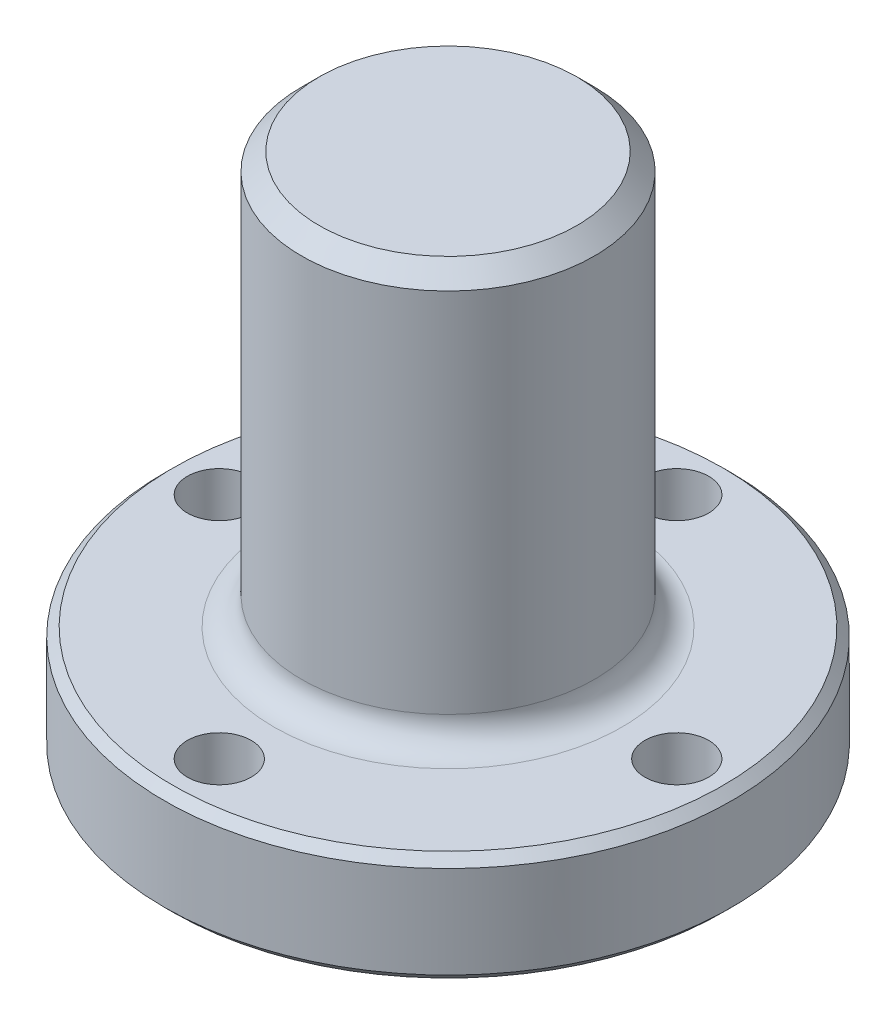
from build123d import *

# Parameters (mm, degrees)
CUT_EXTRUDE2_START = -20.2057
SKETCH2_R          = 2.7686
CUT_EXTRUDE2_DEPTH = 9.525
CUT_EXTRUDE4_START = -20.2057
SKETCH3_R          = 2.7686
CUT_EXTRUDE4_DEPTH = 9.525
FILLET1_R          = 2.3876
CHAMFER1_SIZE      = 0.762
CHAMFER2_SIZE      = 1.524


with BuildPart() as part:
    # Sketch1 → Revolve1 (revolve)
    with BuildSketch(Plane(origin=(0, 0, 0), x_dir=(0, 1, 0), z_dir=(0, 0, 1)), mode=Mode.PRIVATE) as revolve1_sk:
        Polygon((-25.0317, 0), (-25.0317, 8.7122), (-20.2057, 8.7122), (-20.2057, 24.6126), (-10.6807, 24.6126), (-10.6807, 12.7), (25.0317, 12.7), (25.0317, 0), align=None)
    revolve(revolve1_sk.sketch.rotate(Axis((0, -50.4317, 0), (0, 1, 0)), 270), axis=Axis((0, -50.4317, 0), (0, 1, 0)))

    # Sketch2 → Cut-Extrude2 (cut)
    with BuildSketch(Plane(origin=(0, 0, 0), x_dir=(-1, 0, 0), z_dir=(0, 1, 0)).offset(CUT_EXTRUDE2_START)):
        with Locations(Location((19.8374, 0, 0), (0, 0, 270))):
            Circle(SKETCH2_R)
    extrude(amount=CUT_EXTRUDE2_DEPTH, mode=Mode.SUBTRACT)

    # Sketch3 → Cut-Extrude4 (cut)
    with BuildSketch(Plane(origin=(0, 0, 0), x_dir=(-1, 0, 0), z_dir=(0, 1, 0)).offset(CUT_EXTRUDE4_START)):
        with Locations(Location((0, 19.8374, 0), (0, 0, 270))):
            Circle(SKETCH3_R)
        with Locations(Location((-19.8374, 0, 0), (0, 0, 270))):
            Circle(SKETCH3_R)
        with Locations(Location((0, -19.8374, 0), (0, 0, 270))):
            Circle(SKETCH3_R)
    extrude(amount=CUT_EXTRUDE4_DEPTH, mode=Mode.SUBTRACT)

    # Fillet1
    fillet1_edges = [part.edges().sort_by_distance(p)[0] for p in [
        (0, -10.6807, 12.7),
    ]]
    fillet(fillet1_edges, radius=FILLET1_R)

    # Chamfer1
    chamfer1_edges = [part.edges().sort_by_distance(p)[0] for p in [
        (0, -10.6807, 24.6126),
        (0, -20.2057, 24.6126),
    ]]
    chamfer(chamfer1_edges, length=CHAMFER1_SIZE)

    # Chamfer2
    chamfer2_edges = [part.edges().sort_by_distance(p)[0] for p in [
        (0, 25.0317, 12.7),
    ]]
    chamfer(chamfer2_edges, length=CHAMFER2_SIZE)


solid = part.part
